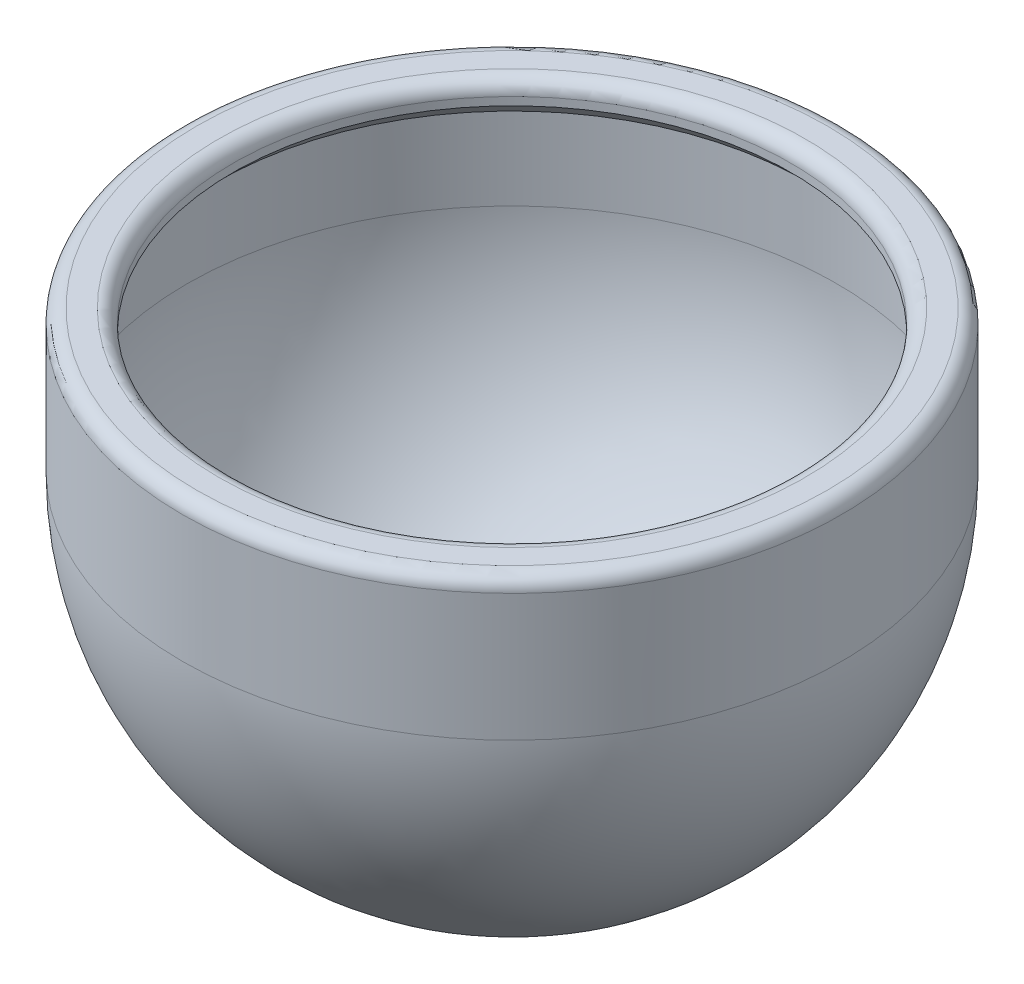
from build123d import *

# Parameters (mm, degrees)
SKETCH1_W = 1
SKETCH1_H = 1


with BuildPart() as part:
    # Sketch1 → Revolve1 (revolve)
    with BuildSketch(Plane.XY, mode=Mode.PRIVATE) as revolve1_sk:
        with BuildLine():
            Line((-70, 26), (-70, 0))
            ThreePointArc((-70, 0), (-49.497474683, -49.497474683), (0, -70))
            Line((0, -70), (0, -69))
            ThreePointArc((0, -69), (-48.790367902, -48.790367902), (-69, 0))
            Line((-69, 0), (-69, 22))
            Line((-69, 22), (-62.585786438, 22))
            Line((-62.585786438, 22), (-59.292893219, 25.292893219))
            Line((-59.292893219, 25.292893219), (-59.292893219, 27))
            Line((-59.292893219, 27), (-60.171572875, 27))
            ThreePointArc((-60.171572875, 27), (-60.043204321, 26.507305936), (-60, 26))
            Line((-60, 26), (-63, 23))
            Line((-63, 23), (-69, 23))
            Line((-69, 23), (-69, 26))
            Line((-69, 26), (-70, 26))
        make_face()
        with Locations((-69.5, 26.5)):
            Rectangle(SKETCH1_W, SKETCH1_H)
        with BuildLine():
            ThreePointArc((-67, 30), (-69.121320344, 29.121320344), (-70, 27))
            Line((-70, 27), (-69, 27))
            ThreePointArc((-69, 27), (-68.414213562, 28.414213562), (-67, 29))
            Line((-67, 29), (-63, 29))
            ThreePointArc((-63, 29), (-61.267949192, 28.449489743), (-60.171572875, 27))
            Line((-60.171572875, 27), (-59.292893219, 27))
            ThreePointArc((-59.292893219, 27), (-60.171572875, 29.121320344), (-62.292893219, 30))
            Line((-62.292893219, 30), (-67, 30))
        make_face()
    revolve(revolve1_sk.sketch.rotate(Axis((0, 64.231283711, 0), (0, -1, 0)), 270), axis=Axis((0, 64.231283711, 0), (0, -1, 0)))


solid = part.part
